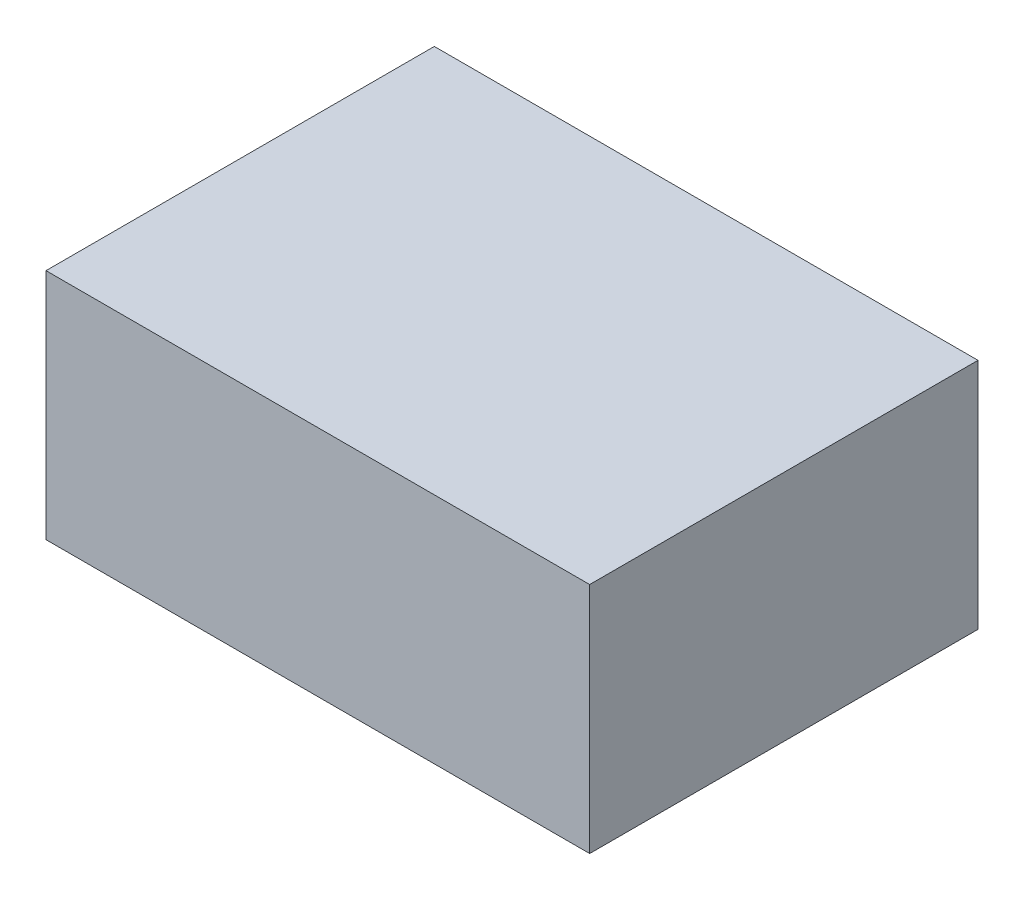
from build123d import *

# Parameters (mm, degrees)
SKETCH_1_W      = 70
SKETCH_1_H      = 50
EXTRUDE_1_DEPTH = 30


with BuildPart() as part:
    # 草图1 → 凸台-拉伸1 (new body)
    with BuildSketch(Plane(origin=(0, 0, 0), x_dir=(1, 0, 0), z_dir=(0, 1, 0))):
        Rectangle(SKETCH_1_W, SKETCH_1_H)
    extrude(amount=EXTRUDE_1_DEPTH)


solid = part.part
